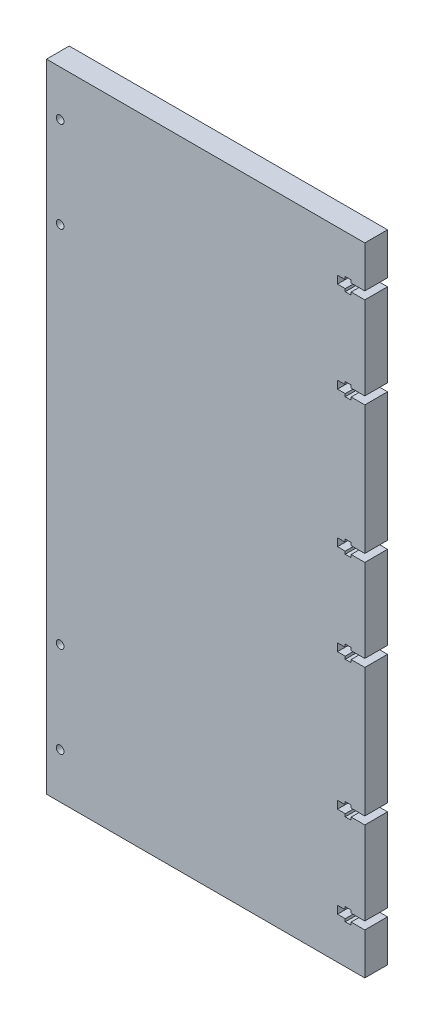
from build123d import *

# Parameters (mm, degrees)
SKETCH1_W           = 177.8
SKETCH1_H           = 355.6
BOSS_EXTRUDE1_DEPTH = 12.7
SKETCH3_R           = 2.159
CUT_EXTRUDE1_DEPTH  = 398.775677989


with BuildPart() as part:
    # Sketch1 → Boss-Extrude1 (new body)
    with BuildSketch(Plane.XY):
        with Locations((88.9, 177.8)):
            Rectangle(SKETCH1_W, SKETCH1_H)
    extrude(amount=BOSS_EXTRUDE1_DEPTH)

    # Sketch3 → Cut-Extrude1 (cut, through all)
    with BuildSketch(Plane.XY.offset(12.7)):
        with Locations((7.62, 330.2)):
            Circle(SKETCH3_R)
        with Locations((7.62, 279.4)):
            Circle(SKETCH3_R)
        with Locations(Location((7.62, 76.2, 0), (0, 0, 180))):
            Circle(SKETCH3_R)
        with Locations(Location((7.62, 25.4, 0), (0, 0, 180))):
            Circle(SKETCH3_R)
        Polygon((177.8, 332.359), (170.18, 332.359), (170.18, 333.883), (166.878, 333.883), (166.878, 332.359), (162.56, 332.359), (162.56, 328.041), (166.878, 328.041), (166.878, 326.517), (170.18, 326.517), (170.18, 328.041), (177.8, 328.041), align=None)
        Polygon((177.8, 281.559), (177.8, 277.241), (170.18, 277.241), (170.18, 275.717), (166.878, 275.717), (166.878, 277.241), (162.56, 277.241), (162.56, 281.559), (166.878, 281.559), (166.878, 283.083), (170.18, 283.083), (170.18, 281.559), align=None)
        Polygon((177.8, 78.359), (170.18, 78.359), (170.18, 79.883), (166.878, 79.883), (166.878, 78.359), (162.56, 78.359), (162.56, 74.041), (166.878, 74.041), (166.878, 72.517), (170.18, 72.517), (170.18, 74.041), (177.8, 74.041), align=None)
        Polygon((177.8, 27.559), (177.8, 23.241), (170.18, 23.241), (170.18, 21.717), (166.878, 21.717), (166.878, 23.241), (162.56, 23.241), (162.56, 27.559), (166.878, 27.559), (166.878, 29.083), (170.18, 29.083), (170.18, 27.559), align=None)
        Polygon((177.8, 205.359), (170.18, 205.359), (170.18, 206.883), (166.878, 206.883), (166.878, 205.359), (162.56, 205.359), (162.56, 201.041), (166.878, 201.041), (166.878, 199.517), (170.18, 199.517), (170.18, 201.041), (177.8, 201.041), align=None)
        Polygon((177.8, 154.559), (177.8, 150.241), (170.18, 150.241), (170.18, 148.717), (166.878, 148.717), (166.878, 150.241), (162.56, 150.241), (162.56, 154.559), (166.878, 154.559), (166.878, 156.083), (170.18, 156.083), (170.18, 154.559), align=None)
    extrude(amount=-CUT_EXTRUDE1_DEPTH, mode=Mode.SUBTRACT)


solid = part.part
